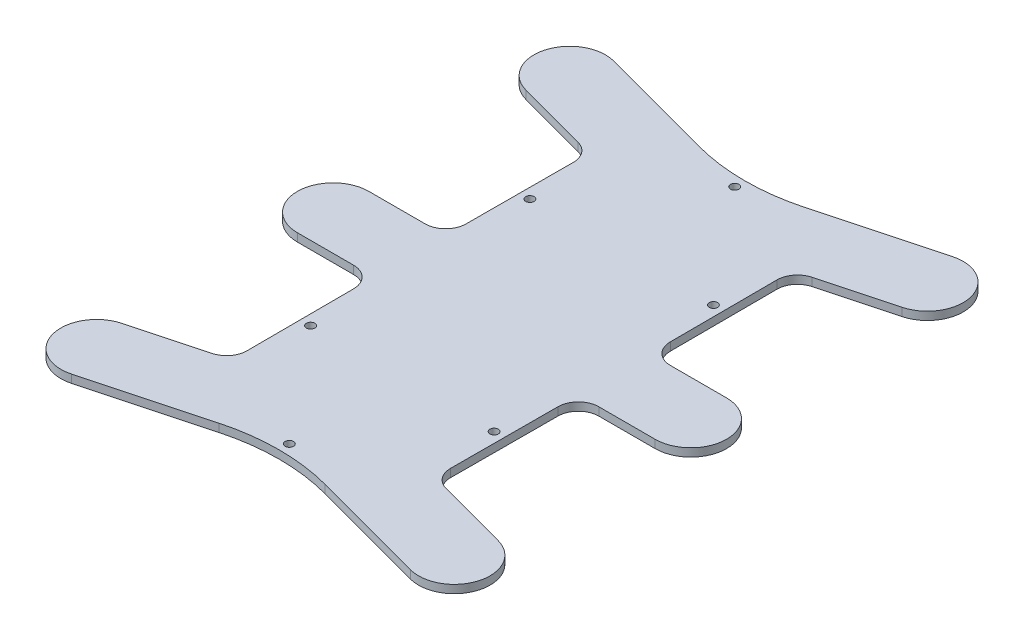
from build123d import *

# Parameters (mm, degrees)
BOSS_EXTRUDE1_DEPTH = 3.175
FILLET1_R           = 80
FILLET2_R           = 8
SKETCH2_R           = 1.65
CUT_EXTRUDE1_DEPTH  = 10


with BuildPart() as part:
    # Sketch1 → Boss-Extrude1 (new body)
    with BuildSketch(Plane(origin=(0, 0, 0), x_dir=(1, 0, 0), z_dir=(0, 1, 0))):
        with BuildLine():
            Line((-70, 14), (-40, 14))
            Line((-40, 14), (-39.816062711, 70))
            Line((-39.816062711, 70), (-73.623466631, 79.058666579))
            ThreePointArc((-73.623466631, 79.058666579), (-83.522961568, 96.205094778), (-66.376533369, 106.104589715))
            Line((-66.376533369, 106.104589715), (0, 88.319051202))
            Line((0, 88.319051202), (66.376533369, 106.104589715))
            ThreePointArc((66.376533369, 106.104589715), (83.522961568, 96.205094778), (73.623466631, 79.058666579))
            Line((73.623466631, 79.058666579), (39.816062711, 70))
            Line((39.816062711, 70), (40, 14))
            Line((40, 14), (70, 14))
            ThreePointArc((70, 14), (84, 0), (70, -14))
            Line((70, -14), (40, -14))
            Line((40, -14), (39.816062711, -70))
            Line((39.816062711, -70), (73.623466631, -79.058666579))
            ThreePointArc((73.623466631, -79.058666579), (83.522961568, -96.205094778), (66.376533369, -106.104589715))
            Line((66.376533369, -106.104589715), (0, -88.319051202))
            Line((0, -88.319051202), (-66.376533369, -106.104589715))
            ThreePointArc((-66.376533369, -106.104589715), (-83.522961568, -96.205094778), (-73.623466631, -79.058666579))
            Line((-73.623466631, -79.058666579), (-39.816062711, -70))
            Line((-39.816062711, -70), (-40, -14))
            Line((-40, -14), (-70, -14))
            ThreePointArc((-70, -14), (-84, 0), (-70, 14))
        make_face()
    extrude(amount=BOSS_EXTRUDE1_DEPTH)

    # Fillet1
    fillet1_edges = [part.edges().sort_by_distance(p)[0] for p in [
        (0, 1.5875, -88.319051202),
        (0, 1.5875, 88.319051202),
    ]]
    fillet(fillet1_edges, radius=FILLET1_R)

    # Fillet2
    fillet2_edges = [part.edges().sort_by_distance(p)[0] for p in [
        (-40, 1.5875, -14),
        (-39.816062711, 1.5875, -70),
        (39.816062711, 1.5875, -70),
        (40, 1.5875, -14),
        (40, 1.5875, 14),
        (39.816062711, 1.5875, 70),
        (-39.816062711, 1.5875, 70),
        (-40, 1.5875, 14),
    ]]
    fillet(fillet2_edges, radius=FILLET2_R)

    # Sketch2 → Cut-Extrude1 (cut)
    with BuildSketch(Plane(origin=(0, 3.175, 0), x_dir=(1, 0, 0), z_dir=(0, 1, 0))):
        with Locations(Location((0, 87.141145635, 0), (0, 0, 270))):
            Circle(SKETCH2_R)
        with Locations(Location((-35.905030257, 42.907120147, 0), (0, 0, 270))):
            Circle(SKETCH2_R)
        with Locations(Location((35.905030257, 42.907120147, 0), (0, 0, 270))):
            Circle(SKETCH2_R)
        with Locations(Location((35.905030257, -42.907120147, 0), (0, 0, 270))):
            Circle(SKETCH2_R)
        with Locations(Location((0, -87.141145635, 0), (0, 0, 270))):
            Circle(SKETCH2_R)
        with Locations(Location((-35.905030257, -42.907120147, 0), (0, 0, 270))):
            Circle(SKETCH2_R)
    extrude(amount=-CUT_EXTRUDE1_DEPTH, mode=Mode.SUBTRACT)


solid = part.part
